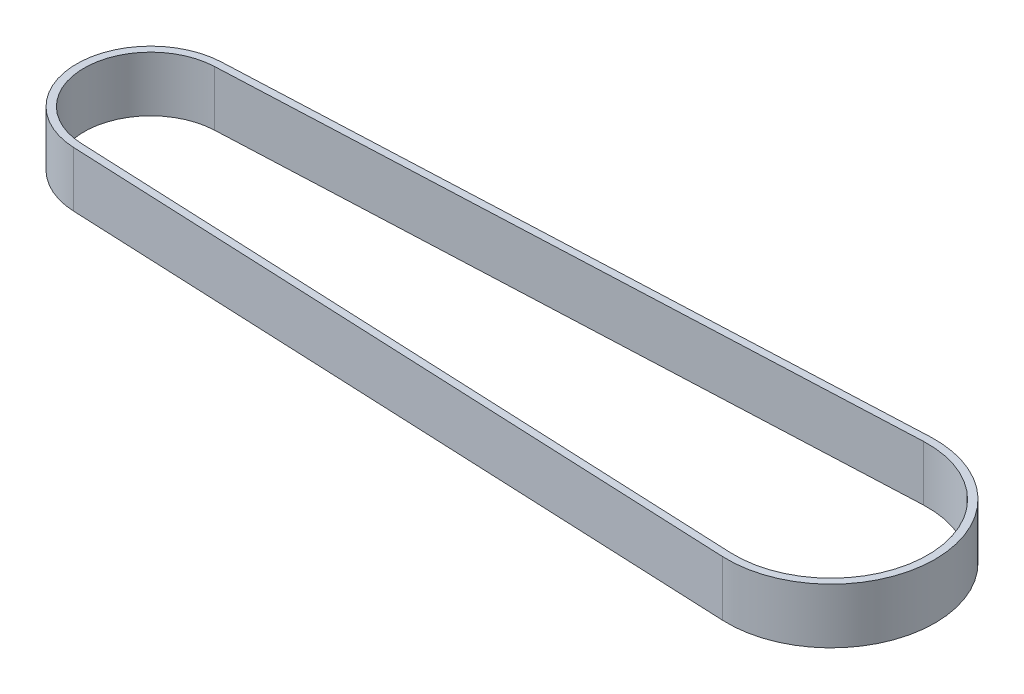
from build123d import *

# Parameters (mm, degrees)
BOSS_EXTRUDE1_DEPTH = 6


with BuildPart() as part:
    # Sketch1 → Boss-Extrude1 (new body)
    with BuildSketch(Plane(origin=(0, 0, 0), x_dir=(1, 0, 0), z_dir=(0, 1, 0))):
        with BuildLine():
            Line((-74.353547297, 8.042232545), (-0.496283784, 11.289096616))
            ThreePointArc((-0.496283784, 11.289096616), (11.3, 0), (-0.496283784, -11.289096616))
            Line((-0.496283784, -11.289096616), (-74.353547297, -8.042232545))
            ThreePointArc((-74.353547297, -8.042232545), (-82.05, 0), (-74.353547297, 8.042232545))
        make_face()
        with BuildLine():
            Line((-74.318412162, 7.243004466), (-0.461148649, 10.489868537))
            ThreePointArc((-0.461148649, 10.489868537), (10.5, 0), (-0.461148649, -10.489868537))
            Line((-0.461148649, -10.489868537), (-74.318412162, -7.243004466))
            ThreePointArc((-74.318412162, -7.243004466), (-81.25, 0), (-74.318412162, 7.243004466))
        make_face(mode=Mode.SUBTRACT)
    extrude(amount=BOSS_EXTRUDE1_DEPTH)


solid = part.part
